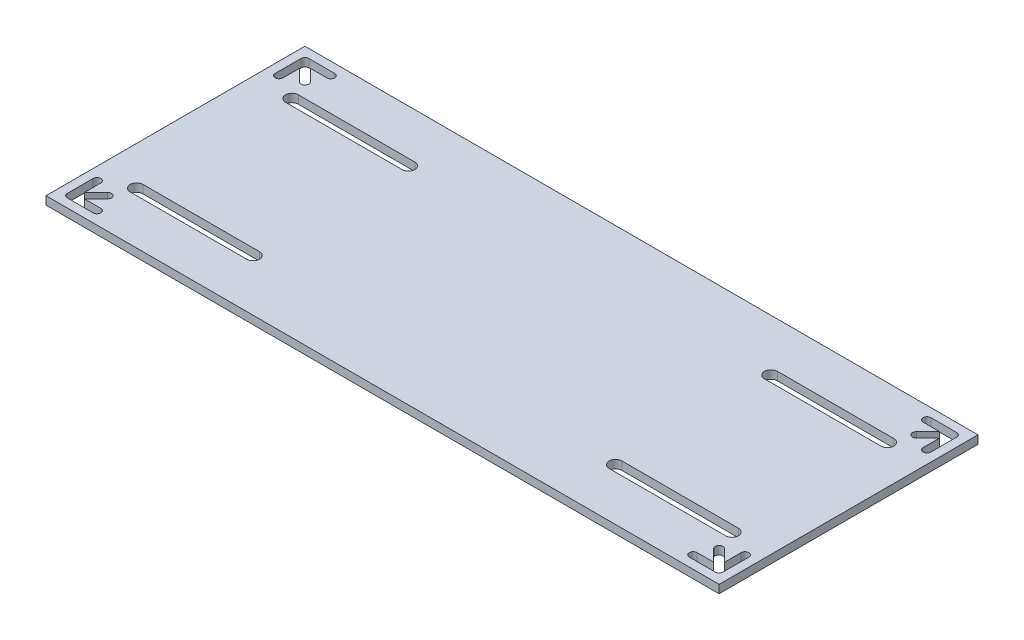
from build123d import *

# Parameters (mm, degrees)
SKETCH1_W            = 260
SKETCH1_H            = 100
BASE_DEPTH           = 3.175
SLOTS_DEPTH          = 140.320065407
MOUNT_HOLES_DEPTH    = 3.175
MIRROR2_COPY_1_DEPTH = 3.175


with BuildPart() as part:
    # Sketch1 → Base (new body)
    with BuildSketch(Plane(origin=(0, 0, 0), x_dir=(1, 0, 0), z_dir=(0, 1, 0))):
        Rectangle(SKETCH1_W, SKETCH1_H)
    extrude(amount=BASE_DEPTH)

    # Sketch2 → Slots (cut, through all)
    with BuildSketch(Plane(origin=(0, 3.175, 0), x_dir=(1, 0, 0), z_dir=(0, 1, 0))):
        with BuildLine():
            Line((-115, 32.5), (-70, 32.5))
            ThreePointArc((-70, 32.5), (-67.5, 30), (-70, 27.5))
            Line((-70, 27.5), (-115, 27.5))
            ThreePointArc((-115, 27.5), (-117.5, 30), (-115, 32.5))
        make_face()
        with BuildLine():
            Line((-115, -32.5), (-70, -32.5))
            ThreePointArc((-70, -32.5), (-67.5, -30), (-70, -27.5))
            Line((-70, -27.5), (-115, -27.5))
            ThreePointArc((-115, -27.5), (-117.5, -30), (-115, -32.5))
        make_face()
        with BuildLine():
            Line((115, 32.5), (70, 32.5))
            ThreePointArc((70, 32.5), (67.5, 30), (70, 27.5))
            Line((70, 27.5), (115, 27.5))
            ThreePointArc((115, 27.5), (117.5, 30), (115, 32.5))
        make_face()
        with BuildLine():
            Line((115, -32.5), (70, -32.5))
            ThreePointArc((70, -32.5), (67.5, -30), (70, -27.5))
            Line((70, -27.5), (115, -27.5))
            ThreePointArc((115, -27.5), (117.5, -30), (115, -32.5))
        make_face()
    extrude(amount=-SLOTS_DEPTH, mode=Mode.SUBTRACT)

    # Sketch3 → Mount Holes (cut)
    with BuildSketch(Plane(origin=(0, 3.175, 0), x_dir=(1, 0, 0), z_dir=(0, 1, 0))):
        with BuildLine():
            Line((-125.150208204, 46.650208204), (-115.150208204, 46.650208204))
            ThreePointArc((-115.150208204, 46.650208204), (-113.650208204, 45.150208204), (-115.150208204, 43.650208204))
            Line((-115.150208204, 43.650208204), (-121.528887861, 43.650208204))
            Line((-121.528887861, 43.650208204), (-117.018480221, 39.139800564))
            ThreePointArc((-117.018480221, 39.139800564), (-117.018480221, 37.018480221), (-119.139800564, 37.018480221))
            Line((-119.139800564, 37.018480221), (-123.650208204, 41.528887861))
            Line((-123.650208204, 41.528887861), (-123.650208204, 35.150208204))
            ThreePointArc((-123.650208204, 35.150208204), (-125.150208204, 33.650208204), (-126.650208204, 35.150208204))
            Line((-126.650208204, 35.150208204), (-126.650208204, 45.150208204))
            ThreePointArc((-126.650208204, 45.150208204), (-126.210868376, 46.210868376), (-125.150208204, 46.650208204))
        make_face()
    mount_holes = extrude(amount=-MOUNT_HOLES_DEPTH, mode=Mode.SUBTRACT)

    # Mirror1: Mount Holes across plane
    add(mount_holes.mirror(Plane(origin=(0, 0, 0), x_dir=(0, 0, 1), z_dir=(1, 0, 0))), mode=Mode.SUBTRACT)

    # Mirror2: Mount Holes across plane
    add(mount_holes.mirror(Plane.XY), mode=Mode.SUBTRACT)

    # Mirror2 copy 1 sketch → Mirror2 copy 1 (cut)
    with BuildSketch(Plane(origin=(0, 3.175, 0), x_dir=(-1, 0, 0), z_dir=(0, 1, 0))):
        with BuildLine():
            Line((-125.150208204, 46.650208204), (-115.150208204, 46.650208204))
            ThreePointArc((-115.150208204, 46.650208204), (-113.650208204, 45.150208204), (-115.150208204, 43.650208204))
            Line((-115.150208204, 43.650208204), (-121.528887861, 43.650208204))
            Line((-121.528887861, 43.650208204), (-117.018480221, 39.139800564))
            ThreePointArc((-117.018480221, 39.139800564), (-117.018480221, 37.018480221), (-119.139800564, 37.018480221))
            Line((-119.139800564, 37.018480221), (-123.650208204, 41.528887861))
            Line((-123.650208204, 41.528887861), (-123.650208204, 35.150208204))
            ThreePointArc((-123.650208204, 35.150208204), (-125.150208204, 33.650208204), (-126.650208204, 35.150208204))
            Line((-126.650208204, 35.150208204), (-126.650208204, 45.150208204))
            ThreePointArc((-126.650208204, 45.150208204), (-126.210868376, 46.210868376), (-125.150208204, 46.650208204))
        make_face()
    extrude(amount=-MIRROR2_COPY_1_DEPTH, mode=Mode.SUBTRACT)


solid = part.part
